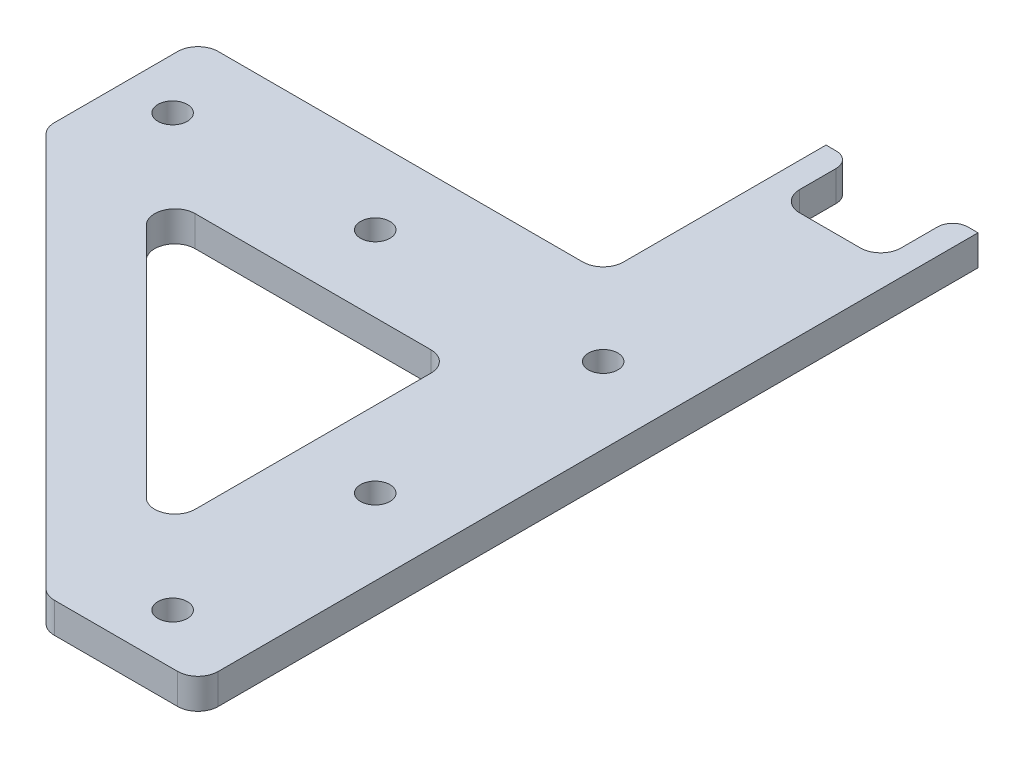
from build123d import *

# Parameters (mm, degrees)
SKETCH_1_R          = 1.45
EXTRUDE_1_DEPTH     = 3
EXTRUDE_2_DEPTH     = 3
SKETCH_4_W          = 40
SKETCH_4_H          = 55
CUT_EXTRUDE_2_DEPTH = 73.734104793
SKETCH_5_W          = 15
SKETCH_5_H          = 22
EXTRUDE_3_DEPTH     = 3
SKETCH_6_W          = 10
SKETCH_6_H          = 7.1
CUT_EXTRUDE_3_DEPTH = 73.734104793
FILLET_1_R          = 2
FILLET_2_R          = 1.5


with BuildPart() as part:
    # 草图1 → 凸台-拉伸1 (new body)
    with BuildSketch(Plane(origin=(0, 0, 0), x_dir=(1, 0, 0), z_dir=(0, 1, 0))):
        Polygon((-47.5, 0), (0, 0), (47.5, 0), (47.5, -15), (7.5, -15), (7.5, -55), (-7.5, -55), (-7.5, -15), (-47.5, -15), align=None)
        with Locations(Location((0, -7.5, 0), (0, 0, 270))):
            Circle(SKETCH_1_R, mode=Mode.SUBTRACT)
        with Locations(Location((0, -30, 0), (0, 0, 270))):
            Circle(SKETCH_1_R, mode=Mode.SUBTRACT)
        with Locations(Location((0, -50, 0), (0, 0, 270))):
            Circle(SKETCH_1_R, mode=Mode.SUBTRACT)
        with Locations(Location((-22.5, -7.5, 0), (0, 0, 270))):
            Circle(SKETCH_1_R, mode=Mode.SUBTRACT)
        with Locations(Location((-42.5, -7.5, 0), (0, 0, 270))):
            Circle(SKETCH_1_R, mode=Mode.SUBTRACT)
        with Locations(Location((42.5, -7.5, 0), (0, 0, 90))):
            Circle(SKETCH_1_R, mode=Mode.SUBTRACT)
        with Locations(Location((22.5, -7.5, 0), (0, 0, 90))):
            Circle(SKETCH_1_R, mode=Mode.SUBTRACT)
    extrude(amount=EXTRUDE_1_DEPTH)

    # 草图2 → 凸台-拉伸2 (add)
    with BuildSketch(Plane(origin=(0, 3, 0), x_dir=(1, 0, 0), z_dir=(0, 1, 0))):
        Polygon((-47.5, -15), (-7.5, -55), (-7.5, -45.100505063), (-37.600505063, -15), align=None)
        Polygon((37.600505063, -15), (47.5, -15), (7.5, -55), (7.5, -45.100505063), align=None)
    extrude(amount=-EXTRUDE_2_DEPTH)

    # 草图4 → 切除-拉伸2 (cut, through all)
    with BuildSketch(Plane(origin=(0, 3, 0), x_dir=(1, 0, 0), z_dir=(0, 1, 0))):
        with Locations((27.5, -27.5)):
            Rectangle(SKETCH_4_W, SKETCH_4_H)
    extrude(amount=-CUT_EXTRUDE_2_DEPTH, mode=Mode.SUBTRACT)

    # 草图5 → 凸台-拉伸3 (add)
    with BuildSketch(Plane(origin=(0, 3, 0), x_dir=(1, 0, 0), z_dir=(0, 1, 0))):
        with Locations((0, 11)):
            Rectangle(SKETCH_5_W, SKETCH_5_H)
    extrude(amount=-EXTRUDE_3_DEPTH)

    # 草图6 → 切除-拉伸3 (cut, through all)
    with BuildSketch(Plane(origin=(0, 3, 0), x_dir=(1, 0, 0), z_dir=(0, 1, 0))):
        with Locations((0, 18.45)):
            Rectangle(SKETCH_6_W, SKETCH_6_H)
    extrude(amount=-CUT_EXTRUDE_3_DEPTH, mode=Mode.SUBTRACT)

    # 圆角1
    fillet_1_edges = [part.edges().sort_by_distance(p)[0] for p in [
        (-7.5, 1.5, 0),
        (-5, 1.5, -14.9),
        (5, 1.5, -14.9),
        (-47.5, 1.5, 0),
        (7.5, 1.5, 55),
        (-7.5, 1.5, 55),
        (-7.5, 1.5, 15),
        (-47.5, 1.5, 15),
        (-7.5, 1.5, 45.100505063),
        (-37.600505063, 1.5, 15),
    ]]
    fillet(fillet_1_edges, radius=FILLET_1_R)

    # 圆角2
    fillet_2_edges = [part.edges().sort_by_distance(p)[0] for p in [
        (-5, 1.5, -22),
        (5, 1.5, -22),
    ]]
    fillet(fillet_2_edges, radius=FILLET_2_R)


solid = part.part
